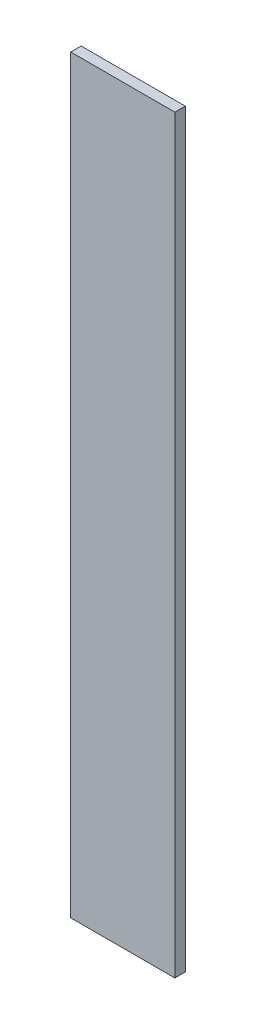
from build123d import *

# Parameters (mm, degrees)
SKETCH1_W           = 31.75
SKETCH1_H           = 3.175
BOSS_EXTRUDE1_DEPTH = 228.6


with BuildPart() as part:
    # Sketch1 → Boss-Extrude1 (new body)
    with BuildSketch(Plane(origin=(0, 0, 0), x_dir=(1, 0, 0), z_dir=(0, 1, 0))):
        Rectangle(SKETCH1_W, SKETCH1_H)
    extrude(amount=BOSS_EXTRUDE1_DEPTH)


solid = part.part
